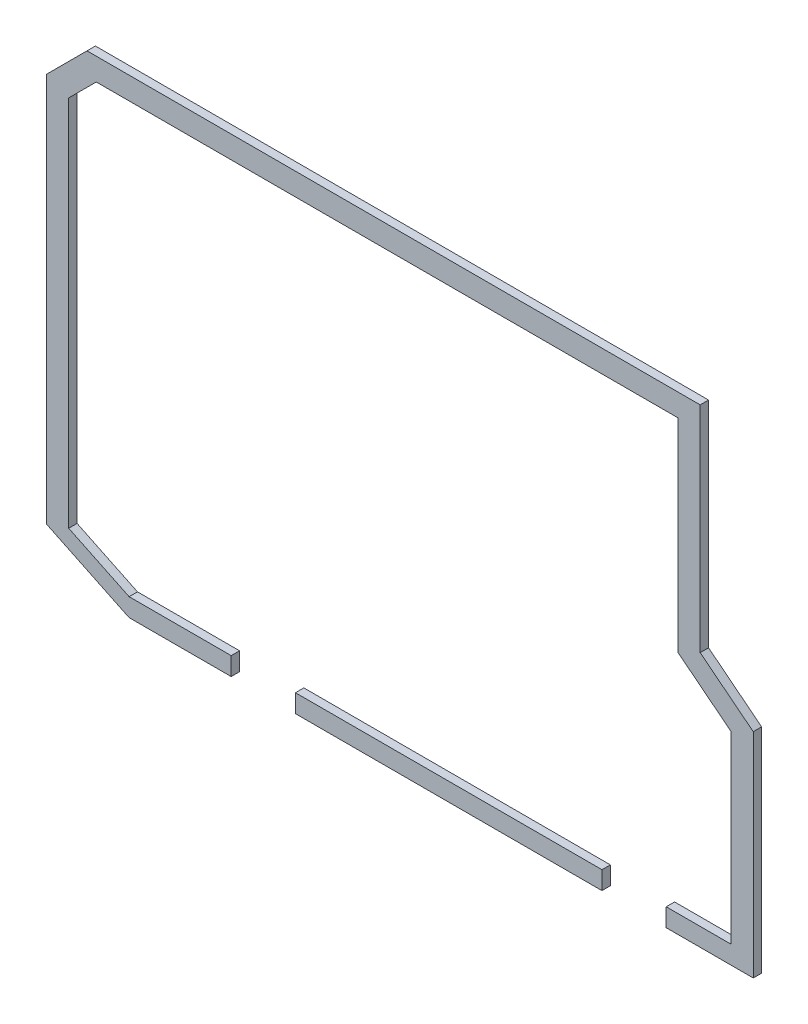
from build123d import *

# Parameters (mm, degrees)
BOSS_EXTRU_1_DEPTH   = 6
ESQUISSE1_W          = 219.4
ESQUISSE1_H          = 13
BOSS_EXTRU_1_2_DEPTH = 6


with BuildPart() as part:
    # Esquisse1 → Boss.-Extru.1 (new body)
    with BuildSketch(Plane.XY):
        Polygon((468.5, 23), (468.5, 175.692213585), (430.5, 205.692213585), (430.5, 359.3), (-8.399494937, 359.3), (-37.5, 330.199494937), (-37.5, 51.474951672), (-29.5, 47.628797826), (21.727899478, 23), (94.8, 23), (94.8, 36), (21.727899478, 36), (-21.5, 56.78264398), (-21.5, 323.572077939), (-1.772077939, 343.3), (414.5, 343.3), (414.5, 197.938582533), (452.5, 167.938582533), (452.5, 36), (406.2, 36), (406.2, 23), (460.5, 23), align=None)
    extrude(amount=BOSS_EXTRU_1_DEPTH)


with BuildPart() as body_2:
    # Esquisse1 → Boss.-Extru.1 2 (new body)
    with BuildSketch(Plane.XY):
        with Locations((250.5, 29.5)):
            Rectangle(ESQUISSE1_W, ESQUISSE1_H)
    extrude(amount=BOSS_EXTRU_1_2_DEPTH)


solid = Compound([part.part, body_2.part])
